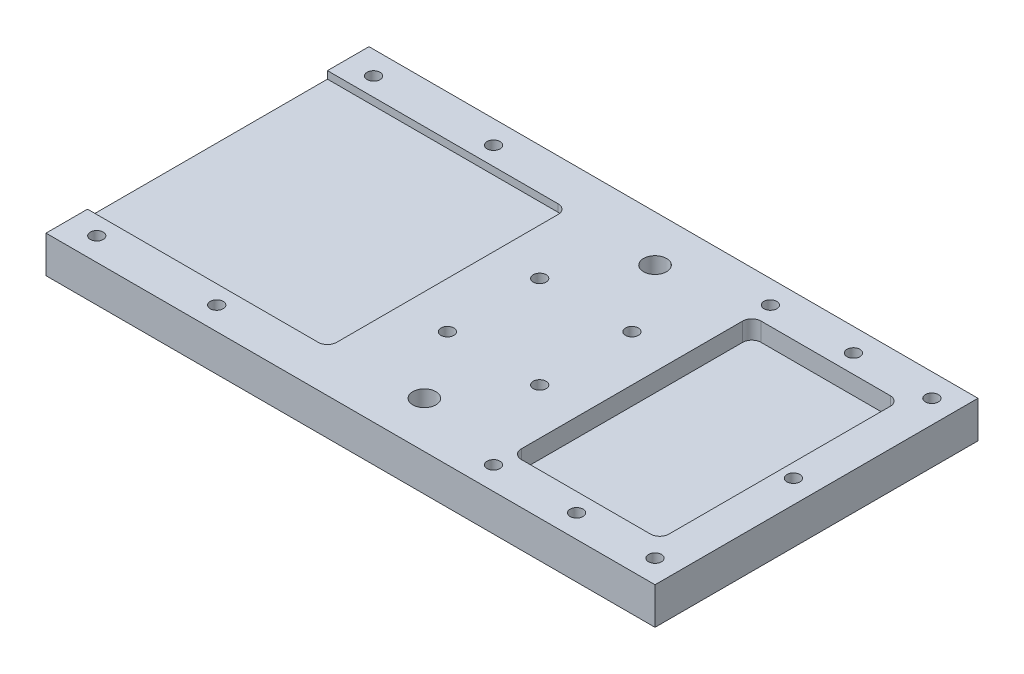
from build123d import *

# Parameters (mm, degrees)
SKETCH1_W           = 101.6
SKETCH1_H           = 44.45
BOSS_EXTRUDE1_DEPTH = 5.08
SKETCH2_R           = 0.889
CUT_EXTRUDE1_DEPTH  = 56.681208904
SKETCH3_R           = 1.2192
SKETCH3_R_2         = 1.5875
CUT_EXTRUDE2_DEPTH  = 56.681208904
SKETCH4_W           = 17.78
SKETCH4_H           = 34.036
CUT_EXTRUDE3_DEPTH  = 56.681208904
FILLET2_R           = 2.54
SKETCH5_W           = 17.78
SKETCH5_H           = 44.45
CUT_EXTRUDE4_DEPTH  = 56.681208904
SKETCH6_W           = 33.02
SKETCH6_H           = 33.02
CUT_EXTRUDE5_DEPTH  = 1.016
FILLET3_R           = 1.27
SKETCH7_W           = 20.32
SKETCH7_H           = 33
CUT_EXTRUDE6_DEPTH  = 2.54
FILLET4_R           = 1.27


with BuildPart() as part:
    # Sketch1 → Boss-Extrude1 (new body)
    with BuildSketch(Plane(origin=(0, 0, 0), x_dir=(1, 0, 0), z_dir=(0, 1, 0))):
        Rectangle(SKETCH1_W, SKETCH1_H)
    extrude(amount=BOSS_EXTRUDE1_DEPTH)

    # Sketch2 → Cut-Extrude1 (cut, through all)
    with BuildSketch(Plane(origin=(0, 5.08, 0), x_dir=(1, 0, 0), z_dir=(0, 1, 0))):
        with Locations(Location((-46.99, 19.05, 0), (0, 0, 270))):
            Circle(SKETCH2_R)
        with Locations(Location((-29.21, 19.05, 0), (0, 0, 270))):
            Circle(SKETCH2_R)
        with Locations(Location((-12.7, 19.05, 0), (0, 0, 270))):
            Circle(SKETCH2_R)
        with Locations(Location((25.4, 19.05, 0), (0, 0, 270))):
            Circle(SKETCH2_R)
        with Locations(Location((36.83, 19.05, 0), (0, 0, 270))):
            Circle(SKETCH2_R)
        with Locations(Location((47.625, 19.05, 0), (0, 0, 270))):
            Circle(SKETCH2_R)
        with Locations(Location((47.625, 0, 0), (0, 0, 270))):
            Circle(SKETCH2_R)
        with Locations(Location((47.625, -19.05, 0), (0, 0, 270))):
            Circle(SKETCH2_R)
        with Locations(Location((36.83, -19.05, 0), (0, 0, 270))):
            Circle(SKETCH2_R)
        with Locations(Location((25.4, -19.05, 0), (0, 0, 270))):
            Circle(SKETCH2_R)
        with Locations(Location((-12.7, -19.05, 0), (0, 0, 270))):
            Circle(SKETCH2_R)
        with Locations(Location((-29.21, -19.05, 0), (0, 0, 270))):
            Circle(SKETCH2_R)
        with Locations(Location((-46.99, -19.05, 0), (0, 0, 270))):
            Circle(SKETCH2_R)
        with Locations(Location((19.05, -6.35, 0), (0, 0, 270))):
            Circle(SKETCH2_R)
        with Locations(Location((19.05, 6.35, 0), (0, 0, 270))):
            Circle(SKETCH2_R)
        with Locations(Location((6.35, 6.35, 0), (0, 0, 270))):
            Circle(SKETCH2_R)
        with Locations(Location((6.35, -6.35, 0), (0, 0, 270))):
            Circle(SKETCH2_R)
    extrude(amount=-CUT_EXTRUDE1_DEPTH, mode=Mode.SUBTRACT)

    # Sketch3 → Cut-Extrude2 (cut, through all)
    with BuildSketch(Plane(origin=(0, 5.08, 0), x_dir=(1, 0, 0), z_dir=(0, 1, 0))):
        with Locations(Location((-37.846, 19.3294, 0), (0, 0, 270))):
            Circle(SKETCH3_R)
        with Locations(Location((12.7, 15.875, 0), (0, 0, 270))):
            Circle(SKETCH3_R_2)
    cut_extrude2 = extrude(amount=-CUT_EXTRUDE2_DEPTH, mode=Mode.SUBTRACT)

    # Mirror1: Cut-Extrude2 across plane
    add(cut_extrude2.mirror(Plane.XY), mode=Mode.SUBTRACT)

    # Sketch4 → Cut-Extrude3 (cut, through all)
    with BuildSketch(Plane(origin=(0, 5.08, 0), x_dir=(1, 0, 0), z_dir=(0, 1, 0))):
        with Locations((-41.91, 0)):
            Rectangle(SKETCH4_W, SKETCH4_H)
    extrude(amount=-CUT_EXTRUDE3_DEPTH, mode=Mode.SUBTRACT)

    # Fillet2
    fillet2_edges = [part.edges().sort_by_distance(p)[0] for p in [
        (-33.02, 2.54, -17.018),
        (-33.02, 2.54, 17.018),
    ]]
    fillet(fillet2_edges, radius=FILLET2_R)

    # Sketch5 → Cut-Extrude4 (cut, through all)
    with BuildSketch(Plane(origin=(0, 5.08, 0), x_dir=(1, 0, 0), z_dir=(0, 1, 0))):
        with Locations((-41.91, 0)):
            Rectangle(SKETCH5_W, SKETCH5_H)
    extrude(amount=-CUT_EXTRUDE4_DEPTH, mode=Mode.SUBTRACT)

    # Sketch6 → Cut-Extrude5 (cut)
    with BuildSketch(Plane(origin=(0, 5.08, 0), x_dir=(1, 0, 0), z_dir=(0, 1, 0))):
        with Locations((-16.51, 0)):
            Rectangle(SKETCH6_W, SKETCH6_H)
    extrude(amount=-CUT_EXTRUDE5_DEPTH, mode=Mode.SUBTRACT)

    # Fillet3
    fillet3_edges = [part.edges().sort_by_distance(p)[0] for p in [
        (0, 4.572, -16.51),
        (0, 4.572, 16.51),
    ]]
    fillet(fillet3_edges, radius=FILLET3_R)

    # Sketch7 → Cut-Extrude6 (cut)
    with BuildSketch(Plane(origin=(0, 5.08, 0), x_dir=(1, 0, 0), z_dir=(0, 1, 0))):
        with Locations((35.56, 0)):
            Rectangle(SKETCH7_W, SKETCH7_H)
    extrude(amount=-CUT_EXTRUDE6_DEPTH, mode=Mode.SUBTRACT)

    # Fillet4
    fillet4_edges = [part.edges().sort_by_distance(p)[0] for p in [
        (45.72, 3.81, -16.5),
        (45.72, 3.81, 16.5),
        (25.4, 3.81, 16.5),
        (25.4, 3.81, -16.5),
    ]]
    fillet(fillet4_edges, radius=FILLET4_R)


solid = part.part
